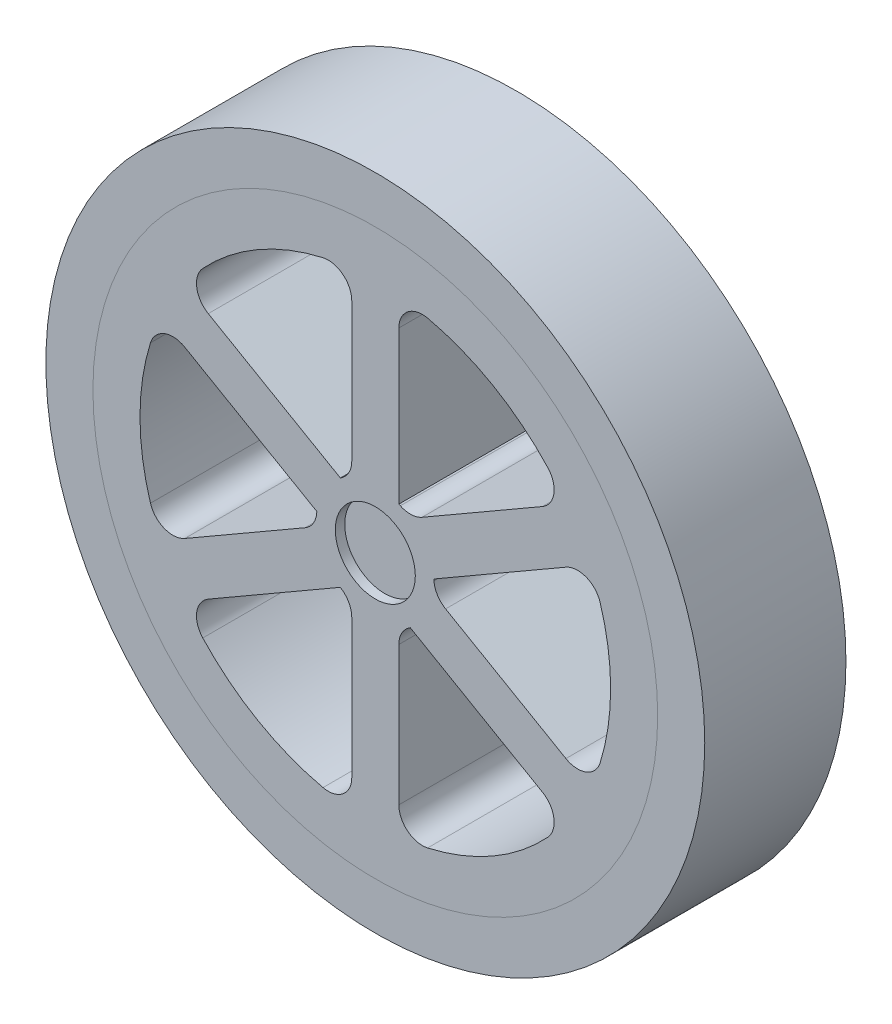
from build123d import *

# Parameters (mm, degrees)
SKETCH_1_R          = 60
EXTRUDE_1_DEPTH     = 30
SKETCH_2_R          = 70
SKETCH_2_R_2        = 60
EXTRUDE_2_DEPTH     = 30
SKETCH_3_R          = 8.5
CUT_EXTRUDE_1_DEPTH = 2


with BuildPart() as part:
    # ｽｹｯﾁ1 → ﾎﾞｽ - 押し出し1 (new body)
    with BuildSketch(Plane.XY):
        Circle(SKETCH_1_R)
        with BuildLine():
            Line((-5, 43.874821937), (-5, 14.361406616))
            ThreePointArc((-5, 14.361406616), (-5.567973698, 12.046856367), (-7.142857143, 10.258147583))
            ThreePointArc((-7.142857143, 10.258147583), (-7.282897486, 10.159202932), (-7.421567416, 10.058346638))
            Line((-7.421567416, 10.058346638), (-35.496710384, 26.267537987))
            ThreePointArc((-35.496710384, 26.267537987), (-37.940750297, 29.851696282), (-36.663011538, 33.997405563))
            ThreePointArc((-36.663011538, 33.997405563), (-25, 43.301270189), (-11.111111111, 48.749802152))
            ThreePointArc((-11.111111111, 48.749802152), (-6.881952178, 47.783501737), (-5, 43.874821937))
        make_face(mode=Mode.SUBTRACT)
        with BuildLine():
            Line((-5, -14.361406616), (-5, -43.874821937))
            ThreePointArc((-5, -43.874821937), (-6.881952178, -47.783501737), (-11.111111111, -48.749802152))
            ThreePointArc((-11.111111111, -48.749802152), (-25, -43.301270189), (-36.663011538, -33.997405563))
            ThreePointArc((-36.663011538, -33.997405563), (-37.940750297, -29.851696282), (-35.496710384, -26.267537987))
            Line((-35.496710384, -26.267537987), (-7.421567416, -10.058346638))
            ThreePointArc((-7.421567416, -10.058346638), (-7.282897486, -10.159202932), (-7.142857143, -10.258147583))
            ThreePointArc((-7.142857143, -10.258147583), (-5.567973698, -12.046856367), (-5, -14.361406616))
        make_face(mode=Mode.SUBTRACT)
        with BuildLine():
            Line((35.496710384, 26.267537987), (9.937342964, 11.510830327))
            ThreePointArc((9.937342964, 11.510830327), (7.648896801, 10.845434853), (5.312387831, 11.314969533))
            ThreePointArc((5.312387831, 11.314969533), (5.156679078, 11.386775702), (5, 11.456439237))
            Line((5, 11.456439237), (5, 43.874821937))
            ThreePointArc((5, 43.874821937), (6.881952178, 47.783501737), (11.111111111, 48.749802152))
            ThreePointArc((11.111111111, 48.749802152), (25, 43.301270189), (36.663011538, 33.997405563))
            ThreePointArc((36.663011538, 33.997405563), (37.940750297, 29.851696282), (35.496710384, 26.267537987))
        make_face(mode=Mode.SUBTRACT)
        with BuildLine():
            Line((-14.937342964, -2.850576289), (-40.496710384, -17.60728395))
            ThreePointArc((-40.496710384, -17.60728395), (-44.822702475, -17.931805455), (-47.774122649, -14.75239659))
            ThreePointArc((-47.774122649, -14.75239659), (-50, 0), (-47.774122649, 14.75239659))
            ThreePointArc((-47.774122649, 14.75239659), (-44.822702475, 17.931805455), (-40.496710384, 17.60728395))
            Line((-40.496710384, 17.60728395), (-12.421567416, 1.3980926))
            ThreePointArc((-12.421567416, 1.3980926), (-12.439576564, 1.22757277), (-12.455244974, 1.05682195))
            ThreePointArc((-12.455244974, 1.05682195), (-13.216870498, -1.201421514), (-14.937342964, -2.850576289))
        make_face(mode=Mode.SUBTRACT)
        with BuildLine():
            Line((40.496710384, -17.60728395), (14.937342964, -2.850576289))
            ThreePointArc((14.937342964, -2.850576289), (13.216870498, -1.201421514), (12.455244974, 1.05682195))
            ThreePointArc((12.455244974, 1.05682195), (12.439576564, 1.22757277), (12.421567416, 1.3980926))
            Line((12.421567416, 1.3980926), (40.496710384, 17.60728395))
            ThreePointArc((40.496710384, 17.60728395), (44.822702475, 17.931805455), (47.774122649, 14.75239659))
            ThreePointArc((47.774122649, 14.75239659), (50, 0), (47.774122649, -14.75239659))
            ThreePointArc((47.774122649, -14.75239659), (44.822702475, -17.931805455), (40.496710384, -17.60728395))
        make_face(mode=Mode.SUBTRACT)
        with BuildLine():
            Line((5, -43.874821937), (5, -14.361406616))
            ThreePointArc((5, -14.361406616), (5.567973698, -12.046856367), (7.142857143, -10.258147583))
            ThreePointArc((7.142857143, -10.258147583), (7.282897486, -10.159202932), (7.421567416, -10.058346638))
            Line((7.421567416, -10.058346638), (35.496710384, -26.267537987))
            ThreePointArc((35.496710384, -26.267537987), (37.940750297, -29.851696282), (36.663011538, -33.997405563))
            ThreePointArc((36.663011538, -33.997405563), (25, -43.301270189), (11.111111111, -48.749802152))
            ThreePointArc((11.111111111, -48.749802152), (6.881952178, -47.783501737), (5, -43.874821937))
        make_face(mode=Mode.SUBTRACT)
    extrude(amount=EXTRUDE_1_DEPTH)

    # ｽｹｯﾁ3 → ｶｯﾄ - 押し出し1 (cut)
    with BuildSketch(Plane.XY.offset(30)):
        Circle(SKETCH_3_R)
    extrude(amount=-CUT_EXTRUDE_1_DEPTH, mode=Mode.SUBTRACT)


with BuildPart() as body_2:
    # ｽｹｯﾁ2 → ﾎﾞｽ - 押し出し2 (new body)
    with BuildSketch(Plane.XY.offset(30)):
        Circle(SKETCH_2_R)
        Circle(SKETCH_2_R_2, mode=Mode.SUBTRACT)
    extrude(amount=-EXTRUDE_2_DEPTH)


solid = Compound([part.part, body_2.part])
